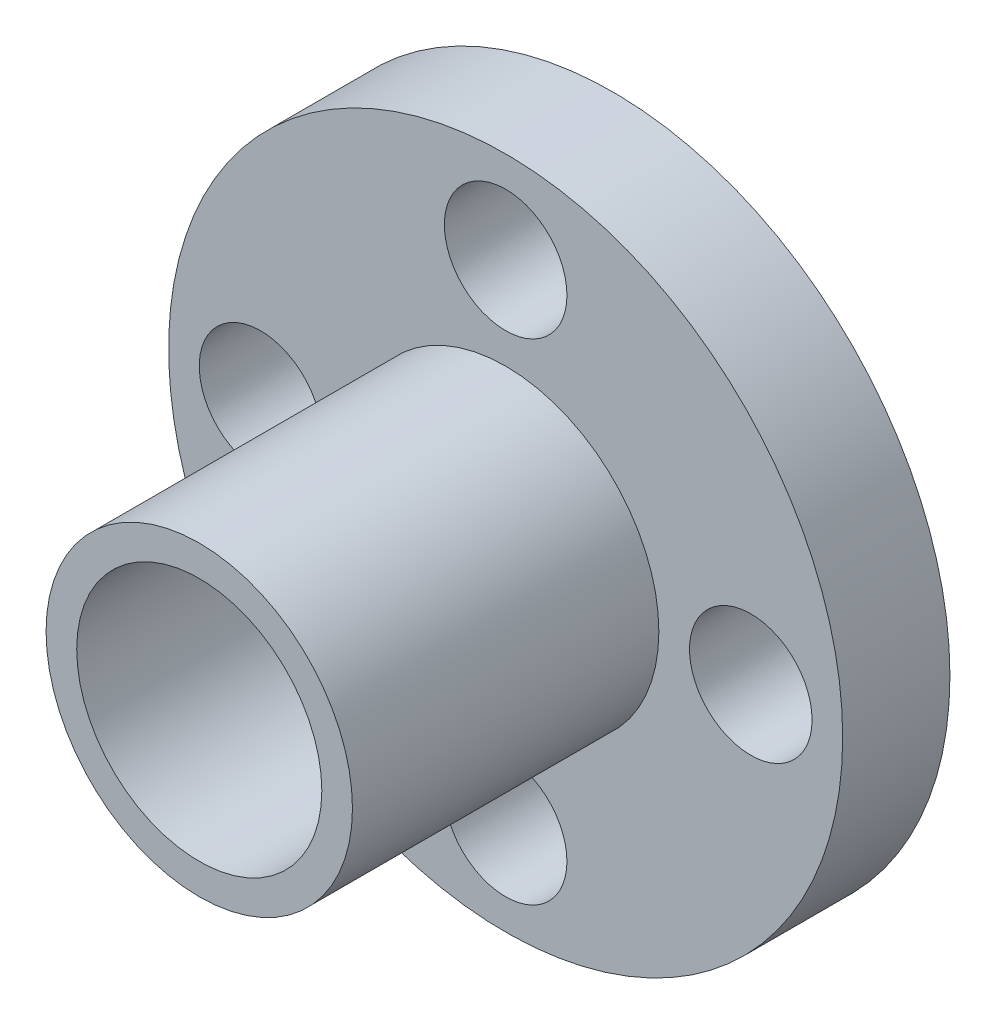
from build123d import *

# Parameters (mm, degrees)
ESQUISSE1_R                  = 5
ESQUISSE1_R_2                = 4
BOSS_EXTRU_1_DEPTH           = 15
BOSS_EXTRU_2_START           = 1.5
ESQUISSE2_R                  = 11
ESQUISSE2_R_2                = 5
BOSS_EXTRU_2_DEPTH           = 3.5
ESQUISSE3_R                  = 2
ENL_V_MAT_EXTRU_1_DEPTH      = 22.610182785
R_P_TITION_CIRCULAIRE1_COUNT = 4


with BuildPart() as part:
    # Esquisse1 → Boss.-Extru.1 (new body)
    with BuildSketch(Plane.XY):
        Circle(ESQUISSE1_R)
        Circle(ESQUISSE1_R_2, mode=Mode.SUBTRACT)
    extrude(amount=BOSS_EXTRU_1_DEPTH)

    # Esquisse2 → Boss.-Extru.2 (add)
    with BuildSketch(Plane.XY.offset(BOSS_EXTRU_2_START)):
        Circle(ESQUISSE2_R)
        Circle(ESQUISSE2_R_2, mode=Mode.SUBTRACT)
    extrude(amount=BOSS_EXTRU_2_DEPTH)

    # Esquisse3 → Enlèv. mat.-Extru.1 (cut, through all)
    with BuildSketch(Plane.XY):
        with Locations((0, 8)):
            Circle(ESQUISSE3_R)
    enl_v_mat_extru_1 = extrude(amount=ENL_V_MAT_EXTRU_1_DEPTH, mode=Mode.SUBTRACT)

    # Répétition circulaire1: Enlèv. mat.-Extru.1 ×4 about axis
    r_p_tition_circulaire1_axis = Axis((0, 0, 0), (0, 0, 1))
    for i in range(1, R_P_TITION_CIRCULAIRE1_COUNT):
        add(enl_v_mat_extru_1.rotate(r_p_tition_circulaire1_axis, i * 360 / R_P_TITION_CIRCULAIRE1_COUNT), mode=Mode.SUBTRACT)


solid = part.part
